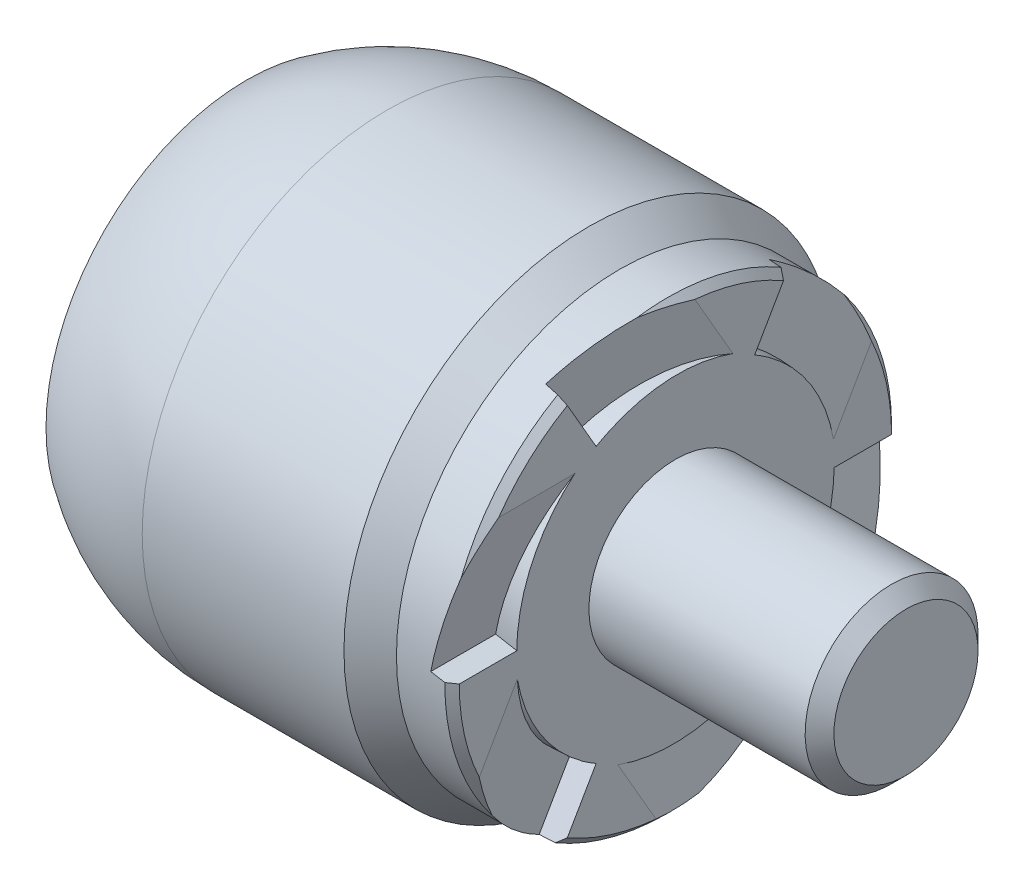
from build123d import *

# Parameters (mm, degrees)
ENL_V_MAT_EXTRU_1_DEPTH      = 1.5
R_P_TITION_CIRCULAIRE1_COUNT = 6


with BuildPart() as part:
    # Esquisse1 → Base-Révolution (revolve)
    with BuildSketch(Plane.XY):
        with BuildLine():
            Line((0, 17), (14, 17))
            Line((14, 17), (16.14222201, 15.5))
            Line((16.14222201, 15.5), (19.5, 15.5))
            Line((19.5, 15.5), (20, 15))
            Line((20, 15), (20, 6))
            Line((20, 6), (35, 6))
            Line((35, 6), (36, 5))
            Line((36, 5), (36, 0))
            Line((36, 0), (16, 0))
            Line((16, 0), (11.958548116, 7))
            Line((11.958548116, 7), (9.746794345, 7))
            ThreePointArc((9.746794345, 7), (2.013063522, 11.829944009), (-6.882917236, 9.829824531))
            Line((-6.882917236, 9.829824531), (-9.750799418, 13.925584753))
            ThreePointArc((-9.750799418, 13.925584753), (-5.111998592, 16.213188163), (0, 17))
        make_face()
    revolve(axis=Axis((94.383348317, 0, 0), (-1, 0, 0)))

    # Esquisse3 → Enlèv. mat.-Extru.1 (cut)
    with BuildSketch(Plane(origin=(19.396926208, -3.420201433, 0), x_dir=(0, 0, -1), z_dir=(0.9848077530122081, -0.1736481776669306, 0))):
        with BuildLine():
            Line((-11, 3.472963553), (-18.209947962, 3.472963553))
            ThreePointArc((-18.209947962, 3.472963553), (-15.606207956, 12.856378604), (-8.539576778, 19.556428144))
            Line((-8.539576778, 19.556428144), (-5.158463097, 13.188428466))
            ThreePointArc((-5.158463097, 13.188428466), (-9.42717068, 9.141160177), (-11, 3.472963553))
        make_face()
    enl_v_mat_extru_1 = extrude(amount=-ENL_V_MAT_EXTRU_1_DEPTH, mode=Mode.SUBTRACT)

    # Répétition circulaire1: Enlèv. mat.-Extru.1 ×6 about axis
    r_p_tition_circulaire1_axis = Axis((94.383348317, 0, 0), (-1, 0, 0))
    for i in range(1, R_P_TITION_CIRCULAIRE1_COUNT):
        add(enl_v_mat_extru_1.rotate(r_p_tition_circulaire1_axis, i * 360 / R_P_TITION_CIRCULAIRE1_COUNT), mode=Mode.SUBTRACT)


solid = part.part
